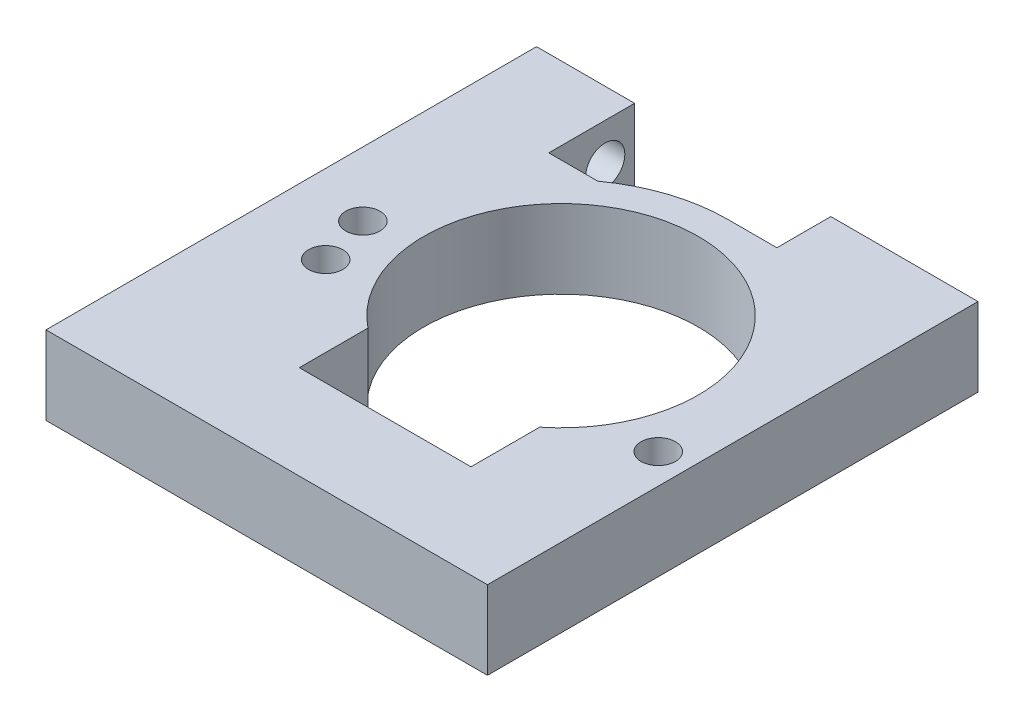
from build123d import *

# Parameters (mm, degrees)
SKETCH2_W                                 = 45
SKETCH2_H                                 = 50
STEPPER_SLIDER_BOSS_EXTRUDE1_DEPTH        = 8
SKETCH1_R                                 = 1.75
STEPPER_HOLE_CUT_EXTRUDE1_DEPTH           = 8
ADJUSTING_SCREW_POCKET_CUT_EXTRUDE1_DEPTH = 8
SKETCH4_R                                 = 2
ADJUSTING_SCREW_HOLE_CUT_EXTRUDE2_DEPTH   = 10


with BuildPart() as part:
    # Sketch2 → Stepper Slider Boss-Extrude1 (new body)
    with BuildSketch(Plane(origin=(0, 0, 0), x_dir=(1, 0, 0), z_dir=(0, 1, 0))):
        with Locations((-2.5, -2.5)):
            Rectangle(SKETCH2_W, SKETCH2_H)
    extrude(amount=-STEPPER_SLIDER_BOSS_EXTRUDE1_DEPTH)

    # Sketch1 → Stepper Hole Cut-Extrude1 (cut)
    with BuildSketch(Plane(origin=(0, 0, 0), x_dir=(1, 0, 0), z_dir=(0, 1, 0))):
        with Locations(Location((-18.45, -1.75, 0), (0, 0, 270))):
            Circle(SKETCH1_R)
        with Locations(Location((16.95, -7.041502622, 0), (0, 0, 270))):
            Circle(SKETCH1_R)
        with Locations(Location((-16.95, -7.041502622, 0), (0, 0, 270))):
            Circle(SKETCH1_R)
        with BuildLine():
            Line((8.75, -17.928746497), (8.75, -10.928746497))
            ThreePointArc((8.75, -10.928746497), (0, 14), (-8.75, -10.928746497))
            Line((-8.75, -10.928746497), (-8.75, -17.928746497))
            Line((-8.75, -17.928746497), (8.75, -17.928746497))
        make_face()
    extrude(amount=-STEPPER_HOLE_CUT_EXTRUDE1_DEPTH, mode=Mode.SUBTRACT)

    # Sketch3 → Adjusting Screw Pocket Cut-Extrude1 (cut)
    with BuildSketch(Plane(origin=(0, 0, 0), x_dir=(1, 0, 0), z_dir=(0, 1, 0))):
        with BuildLine():
            Line((0, 22.5), (-15, 22.5))
            Line((-15, 22.5), (-15, 13.747727085))
            Line((-15, 13.747727085), (-10, 13.747727085))
            ThreePointArc((-10, 13.747727085), (-5.257786585, 16.1664987), (0, 17))
            Line((0, 17), (5, 17))
            Line((5, 17), (5, 22.5))
            Line((5, 22.5), (0, 22.5))
        make_face()
    extrude(amount=-ADJUSTING_SCREW_POCKET_CUT_EXTRUDE1_DEPTH, mode=Mode.SUBTRACT)

    # Sketch4 → Adjusting Screw Hole Cut-Extrude2 (cut)
    with BuildSketch(Plane(origin=(-15, 0, 0), x_dir=(0, 0, -1), z_dir=(1, 0, 0))):
        with Locations((19.5, -4)):
            Circle(SKETCH4_R)
    extrude(amount=-ADJUSTING_SCREW_HOLE_CUT_EXTRUDE2_DEPTH, mode=Mode.SUBTRACT)


solid = part.part
